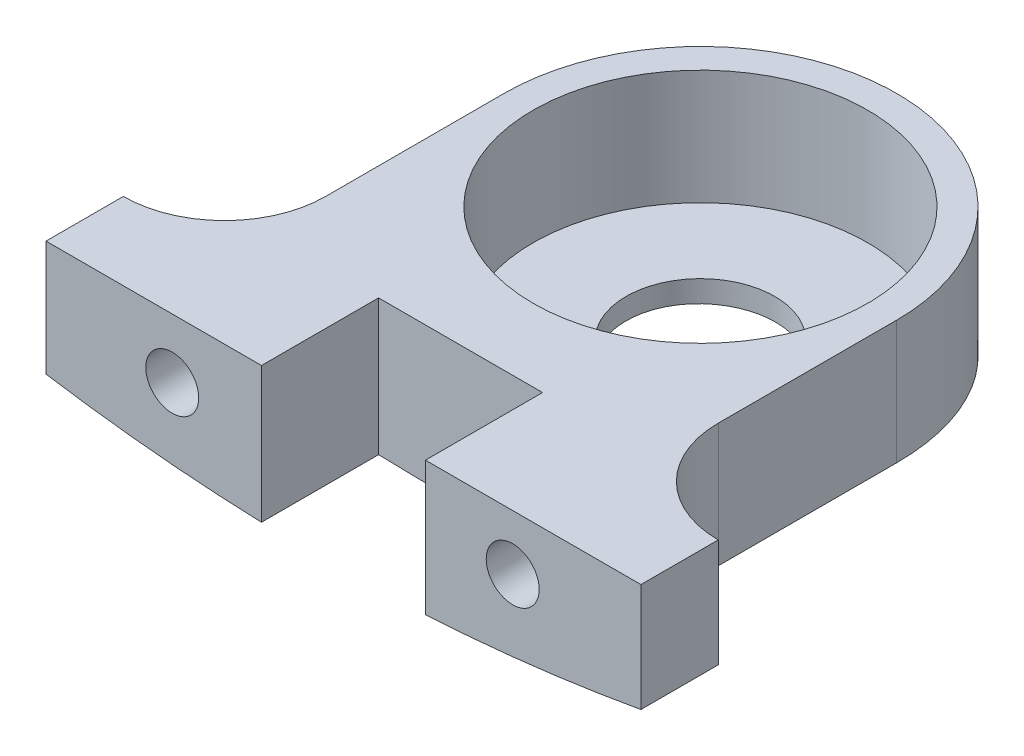
from build123d import *

# Parameters (mm, degrees)
SKETCH1_W           = 25.4
SKETCH1_H           = 23.622
BOSS_EXTRUDE1_DEPTH = 5.842
SKETCH2_R           = 3.175
CUT_EXTRUDE1_DEPTH  = 36.175102672
SKETCH3_R           = 7.14375
CUT_EXTRUDE2_DEPTH  = 4.9022
CUT_EXTRUDE3_DEPTH  = 36.175102672
CUT_EXTRUDE4_DEPTH  = 36.175102672
SKETCH6_W           = 7
SKETCH6_H           = 5
CUT_EXTRUDE5_DEPTH  = 36.175102828
SKETCH8_R           = 1.1303
CUT_EXTRUDE6_DEPTH  = 6.35


with BuildPart() as part:
    # Sketch1 → Boss-Extrude1 (new body)
    with BuildSketch(Plane(origin=(0, 0, 0), x_dir=(1, 0, 0), z_dir=(0, 1, 0))):
        with Locations((12.7, 11.811)):
            Rectangle(SKETCH1_W, SKETCH1_H)
    extrude(amount=BOSS_EXTRUDE1_DEPTH)

    # Sketch2 → Cut-Extrude1 (cut, through all)
    with BuildSketch(Plane(origin=(0, 5.842, 0), x_dir=(1, 0, 0), z_dir=(0, 1, 0))):
        with Locations(Location((12.7, 15.24, 0), (0, 0, 270))):
            Circle(SKETCH2_R)
    extrude(amount=-CUT_EXTRUDE1_DEPTH, mode=Mode.SUBTRACT)

    # Sketch3 → Cut-Extrude2 (cut)
    with BuildSketch(Plane(origin=(0, 5.842, 0), x_dir=(1, 0, 0), z_dir=(0, 1, 0))):
        with Locations(Location((12.7, 15.24, 0), (0, 0, 270))):
            Circle(SKETCH3_R)
    extrude(amount=-CUT_EXTRUDE2_DEPTH, mode=Mode.SUBTRACT)

    # Sketch4 → Cut-Extrude3 (cut, through all)
    with BuildSketch(Plane(origin=(0, 5.842, 0), x_dir=(1, 0, 0), z_dir=(0, 1, 0))):
        with BuildLine():
            ThreePointArc((4.318, 15.24), (6.77303096, 21.16696904), (12.7, 23.622))
            Line((12.7, 23.622), (0, 23.622))
            Line((0, 23.622), (0, 3.302))
            ThreePointArc((0, 3.302), (3.053287081, 4.566712919), (4.318, 7.62))
            Line((4.318, 7.62), (4.318, 15.24))
        make_face()
        with BuildLine():
            ThreePointArc((12.7, 23.622), (18.62696904, 21.16696904), (21.082, 15.24))
            Line((21.082, 15.24), (21.082, 7.62))
            ThreePointArc((21.082, 7.62), (22.346712919, 4.566712919), (25.4, 3.302))
            Line((25.4, 3.302), (25.4, 23.622))
            Line((25.4, 23.622), (12.7, 23.622))
        make_face()
    extrude(amount=-CUT_EXTRUDE3_DEPTH, mode=Mode.SUBTRACT)

    # Sketch5 → Cut-Extrude4 (cut, through all)
    with BuildSketch(Plane.XY):
        with BuildLine():
            Line((0, 0.920917387), (0, 0))
            Line((0, 0), (11.811, 0))
            ThreePointArc((11.811, 0), (5.887575951, 0.230578207), (0, 0.920917387))
        make_face()
        with BuildLine():
            ThreePointArc((25.4, 1.221475881), (18.632893512, 0.305983313), (11.811, 0))
            Line((11.811, 0), (25.4, 0))
            Line((25.4, 0), (25.4, 1.221475881))
        make_face()
    extrude(amount=-CUT_EXTRUDE4_DEPTH, mode=Mode.SUBTRACT)

    # Sketch6 → Cut-Extrude5 (cut, through all)
    with BuildSketch(Plane(origin=(0, 5.842, 0), x_dir=(1, 0, 0), z_dir=(0, 1, 0))):
        with Locations((12.700000015, 2.5)):
            Rectangle(SKETCH6_W, SKETCH6_H)
    extrude(amount=-CUT_EXTRUDE5_DEPTH, mode=Mode.SUBTRACT)

    # Sketch8 → Cut-Extrude6 (cut)
    with BuildSketch(Plane.XY):
        with Locations((5.390000015, 3.302)):
            Circle(SKETCH8_R)
        with Locations(Location((19.925856856, 3.487249582, 0), (0, 0, 180))):
            Circle(SKETCH8_R)
    extrude(amount=-CUT_EXTRUDE6_DEPTH, mode=Mode.SUBTRACT)


solid = part.part
